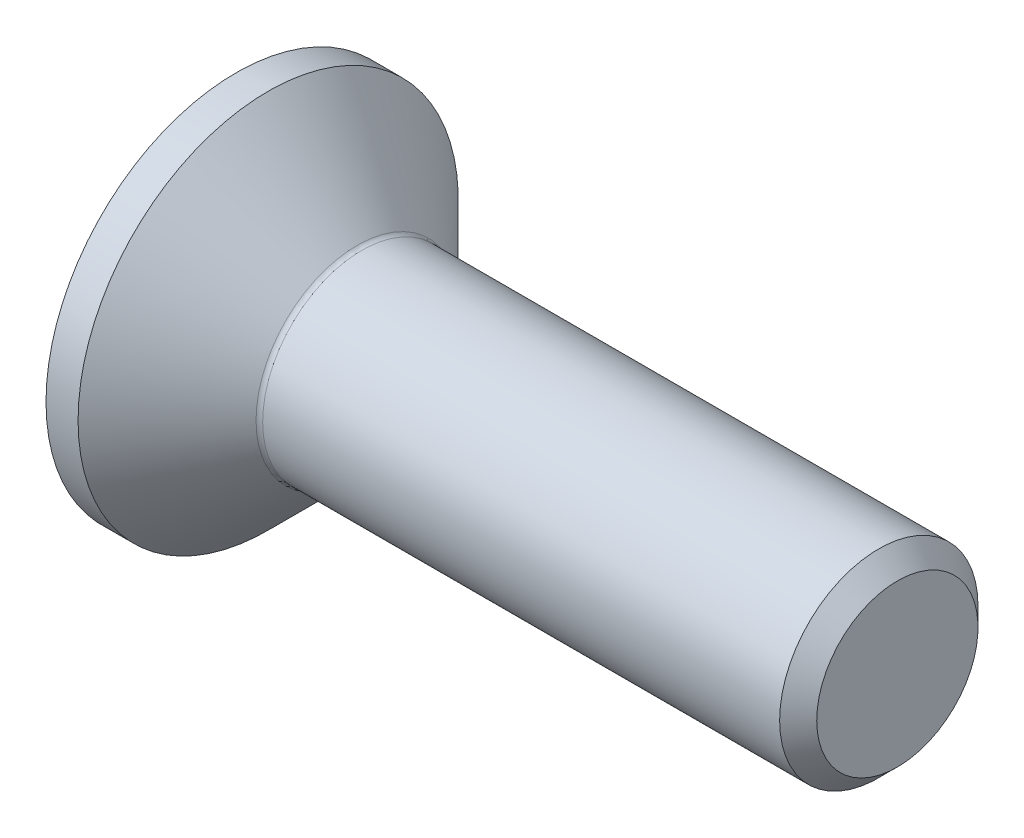
from build123d import *

# Parameters (mm, degrees)
FILLET1_R   = 0.1
HEX_2_DEPTH = 1.1


with BuildPart() as part:
    # BodySke → BaseBody (revolve)
    with BuildSketch(Plane.XY, mode=Mode.PRIVATE) as basebody_sk:
        Polygon((0, 0), (0, 2.875), (0.485, 2.875), (1.86, 1.5), (9.7195, 1.5), (10, 1.2195), (10, 0), align=None)
    revolve(basebody_sk.sketch.rotate(Axis((0, 0, 0), (1, 0, 0)), 90), axis=Axis((0, 0, 0), (1, 0, 0)))

    # Fillet1
    fillet1_edges = [part.edges().sort_by_distance(p)[0] for p in [
        (1.86, 0, -1.5),
    ]]
    fillet(fillet1_edges, radius=FILLET1_R)

    # Sketch2 → PreBroach (revolve, cut)
    with BuildSketch(Plane.XY, mode=Mode.PRIVATE) as prebroach_sk:
        Polygon((0, 1), (1.1, 1), (1.677350269, 0), (0, 0), align=None)
    revolve(prebroach_sk.sketch.rotate(Axis((0, 0, 0), (1, 0, 0)), 90), axis=Axis((0, 0, 0), (1, 0, 0)), mode=Mode.SUBTRACT)

    # Sketch3 → Hex 2 (cut)
    with BuildSketch(Plane.ZY):
        Polygon((-1, -0.577350269), (-1, 0.577350269), (0, 1.154700538), (1, 0.577350269), (1, -0.577350269), (0, -1.154700538), align=None)
    extrude(amount=-HEX_2_DEPTH, mode=Mode.SUBTRACT)


solid = part.part
